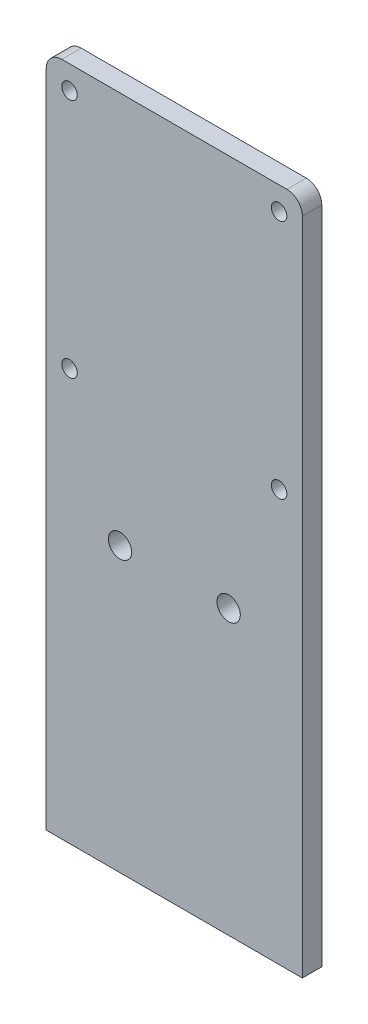
from build123d import *

# Parameters (mm, degrees)
SKETCH1_R           = 1
SKETCH1_R_2         = 1.5
BOSS_EXTRUDE1_DEPTH = 2.5


with BuildPart() as part:
    # Sketch1 → Boss-Extrude1 (new body)
    with BuildSketch(Plane.XY):
        with BuildLine():
            Line((0, 0), (33, 0))
            Line((33, 0), (33, 85))
            ThreePointArc((33, 85), (32.414213562, 86.414213562), (31, 87))
            Line((31, 87), (2, 87))
            ThreePointArc((2, 87), (0.585786438, 86.414213562), (0, 85))
            Line((0, 85), (0, 0))
        make_face()
        with Locations((3, 84)):
            Circle(SKETCH1_R, mode=Mode.SUBTRACT)
        with Locations(Location((3, 53, 0), (0, 0, 180))):
            Circle(SKETCH1_R, mode=Mode.SUBTRACT)
        with Locations((9.5, 36.5)):
            Circle(SKETCH1_R_2, mode=Mode.SUBTRACT)
        with Locations(Location((23.5, 36.5, 0), (0, 0, 180))):
            Circle(SKETCH1_R_2, mode=Mode.SUBTRACT)
        with Locations((30, 53)):
            Circle(SKETCH1_R, mode=Mode.SUBTRACT)
        with Locations(Location((30, 84, 0), (0, 0, 180))):
            Circle(SKETCH1_R, mode=Mode.SUBTRACT)
    extrude(amount=BOSS_EXTRUDE1_DEPTH)


solid = part.part
